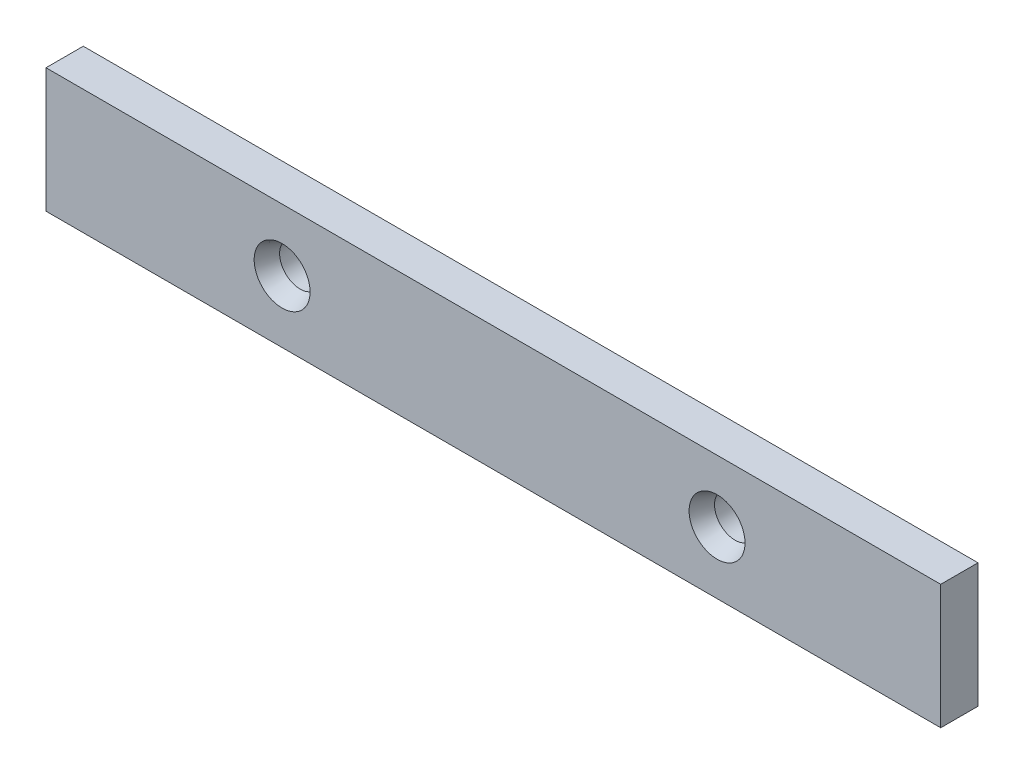
from build123d import *

# Parameters (mm, degrees)
SKETCH1_W                                      = 144
SKETCH1_H                                      = 20
EXTRUDE1_DEPTH                                 = 6
CSK_FOR_M6_FLAT_HEAD_MACHINE_SCREW4_AT_2_COUNT = 2
CSK_FOR_M6_FLAT_HEAD_MACHINE_SCREW4_AT_2_PITCH = 70


with BuildPart() as part:
    # Sketch1 → Extrude1 (new body)
    with BuildSketch(Plane.XY):
        with Locations((72, 10)):
            Rectangle(SKETCH1_W, SKETCH1_H)
    extrude(amount=EXTRUDE1_DEPTH)

    # Sketch9 → CSK for M6 Flat Head Machine Screw4 (revolve, cut)
    with BuildSketch(Plane(origin=(38, 10, 6), x_dir=(0, -1, 0), z_dir=(1, 0, 0))):
        Polygon((0, 0), (0, 6), (3.3, 6), (3.3, 2.897056275), (4.5, 0), align=None)
    csk_for_m6_flat_head_machine_screw4 = revolve(axis=Axis((38, 10, 12.35), (0, 0, -1)), mode=Mode.SUBTRACT)

    # CSK for M6 Flat Head Machine Screw4 at 2: CSK for M6 Flat Head Machine Screw4 ×2
    with Locations(*[(i * CSK_FOR_M6_FLAT_HEAD_MACHINE_SCREW4_AT_2_PITCH, 0, 0) for i in range(1, CSK_FOR_M6_FLAT_HEAD_MACHINE_SCREW4_AT_2_COUNT)]):
        add(csk_for_m6_flat_head_machine_screw4, mode=Mode.SUBTRACT)


solid = part.part
